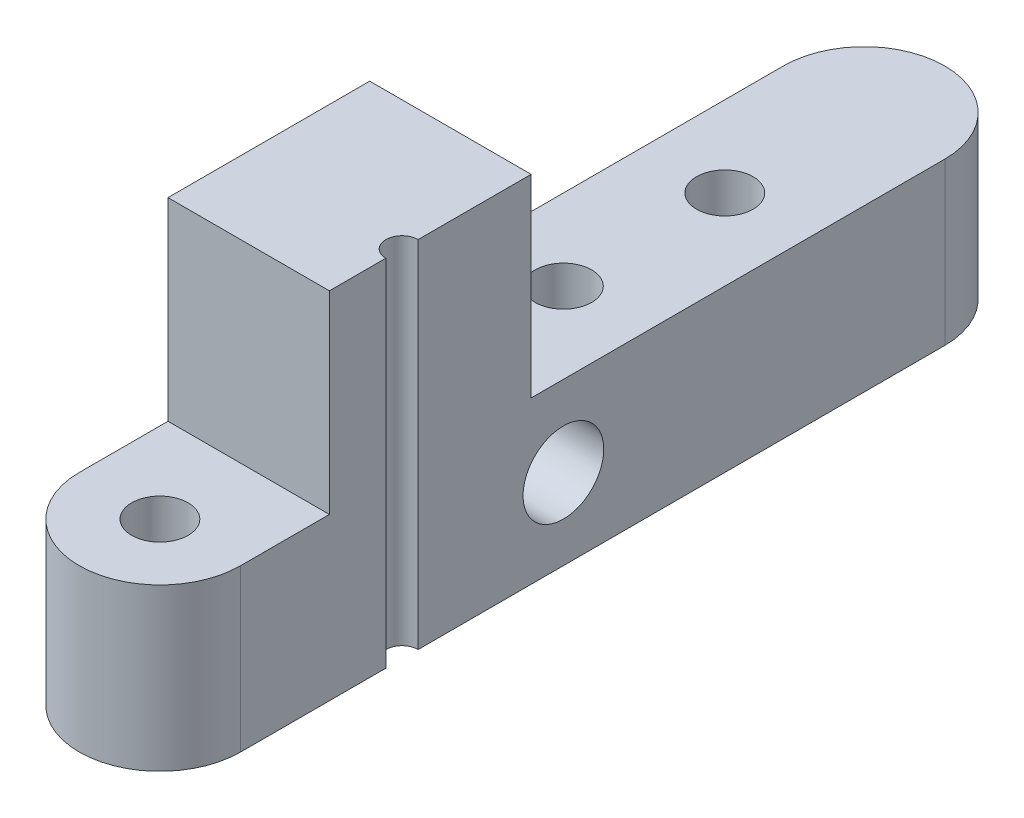
from build123d import *

# Parameters (mm, degrees)
SKETCH1_R           = 1.75
BOSS_EXTRUDE1_DEPTH = 10
SKETCH2_R           = 2.5
CUT_EXTRUDE1_DEPTH  = 51.644943511
BOSS_EXTRUDE2_DEPTH = 12
SKETCH4_R           = 2
CUT_EXTRUDE2_DEPTH  = 25


with BuildPart() as part:
    # Sketch1 → Boss-Extrude1 (new body)
    with BuildSketch(Plane(origin=(0, 0, 0), x_dir=(1, 0, 0), z_dir=(0, 1, 0))):
        with BuildLine():
            Line((-5, 0), (-5, 43.630343442))
            ThreePointArc((-5, 43.630343442), (0, 48.630343442), (5, 43.630343442))
            Line((5, 43.630343442), (5, 11))
            ThreePointArc((5, 11), (4, 10), (5, 9))
            Line((5, 9), (5, 0))
            ThreePointArc((5, 0), (0, -5), (-5, 0))
        make_face()
        with Locations(Location((0, 0, 0), (0, 0, 270))):
            Circle(SKETCH1_R, mode=Mode.SUBTRACT)
        with Locations(Location((0, 25, 0), (0, 0, 270))):
            Circle(SKETCH1_R, mode=Mode.SUBTRACT)
        with Locations(Location((0, 35, 0), (0, 0, 270))):
            Circle(SKETCH1_R, mode=Mode.SUBTRACT)
    extrude(amount=BOSS_EXTRUDE1_DEPTH)

    # Sketch2 → Cut-Extrude1 (cut, through all)
    with BuildSketch(Plane(origin=(5, 0, 0), x_dir=(0, 0, -1), z_dir=(1, 0, 0))):
        with Locations((20, 5)):
            Circle(SKETCH2_R)
    extrude(amount=-CUT_EXTRUDE1_DEPTH, mode=Mode.SUBTRACT)

    # Sketch3 → Boss-Extrude2 (add)
    with BuildSketch(Plane(origin=(0, 10, 0), x_dir=(1, 0, 0), z_dir=(0, 1, 0))):
        with BuildLine():
            Line((5, 5.5), (-5, 5.5))
            Line((-5, 5.5), (-5, 18))
            Line((-5, 18), (5, 18))
            Line((5, 18), (5, 11))
            ThreePointArc((5, 11), (4, 10), (5, 9))
            Line((5, 9), (5, 5.5))
        make_face()
    extrude(amount=BOSS_EXTRUDE2_DEPTH)

    # Sketch4 → Cut-Extrude2 (cut)
    with BuildSketch(Plane.XY.offset(-55)):
        with Locations(Location((0, 5, 0), (0, 0, 180))):
            Circle(SKETCH4_R)
    extrude(amount=CUT_EXTRUDE2_DEPTH, mode=Mode.SUBTRACT)


solid = part.part
